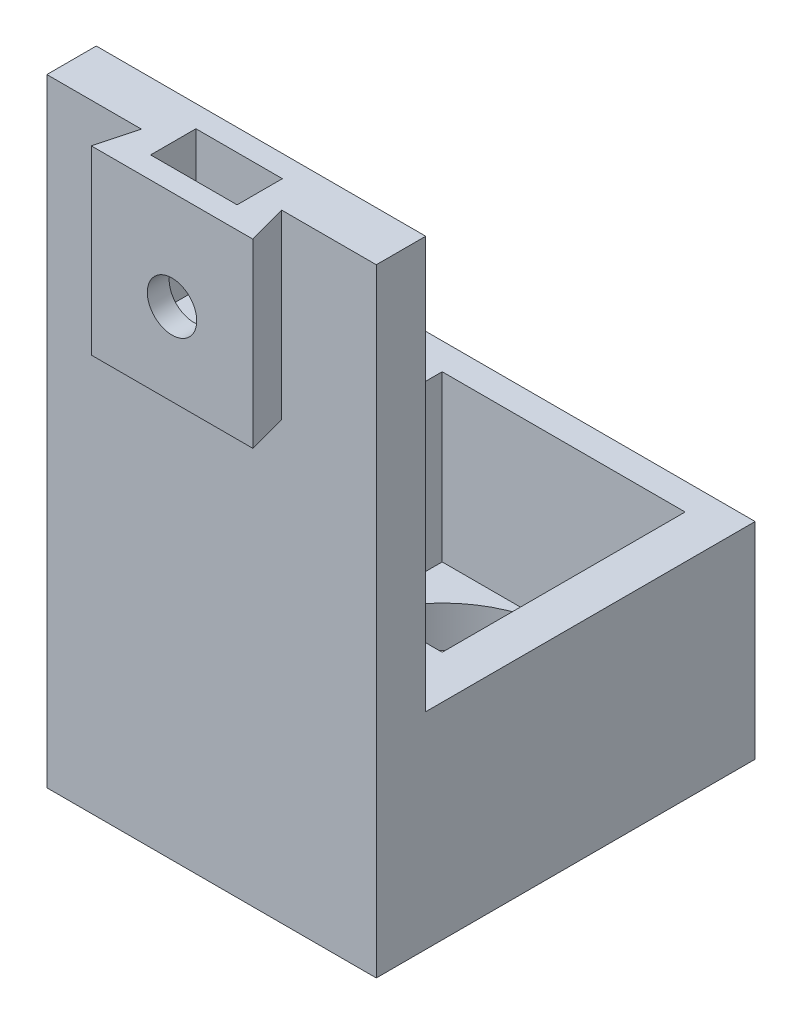
from build123d import *

# Parameters (mm, degrees)
SKIZZE1_W                       = 40
SKIZZE1_H                       = 75
AUFSATZ_LINEAR_AUSTRAGEN1_DEPTH = 6
AUFSATZ_LINEAR_AUSTRAGEN2_DEPTH = 22
SKIZZE3_W                       = 10.5
SKIZZE3_H                       = 5.5
SCHNITT_LINEAR_AUSTRAGEN1_DEPTH = 17
SKIZZE4_R                       = 3
SCHNITT_LINEAR_AUSTRAGEN2_DEPTH = 79.368616167
SKIZZE5_W                       = 40
SKIZZE5_H                       = 25
AUFSATZ_LINEAR_AUSTRAGEN3_DEPTH = 40
SKIZZE6_W                       = 29.5
SKIZZE6_H                       = 29.5
SCHNITT_LINEAR_AUSTRAGEN3_DEPTH = 20
SKIZZE7_R                       = 14.75
SCHNITT_LINEAR_AUSTRAGEN4_DEPTH = 84.066238629


with BuildPart() as part:
    # Skizze1 → Aufsatz-Linear austragen1 (new body)
    with BuildSketch(Plane.XY):
        with Locations((0, 37.5)):
            Rectangle(SKIZZE1_W, SKIZZE1_H)
    extrude(amount=AUFSATZ_LINEAR_AUSTRAGEN1_DEPTH)

    # Skizze2 → Aufsatz-Linear austragen2 (add)
    with BuildSketch(Plane(origin=(0, 75, 0), x_dir=(1, 0, 0), z_dir=(0, 1, 0))):
        Polygon((8.513843876, -6), (-8.513843876, -6), (-9.8, -10.8), (9.8, -10.8), align=None)
    extrude(amount=-AUFSATZ_LINEAR_AUSTRAGEN2_DEPTH)

    # Skizze3 → Schnitt-Linear austragen1 (cut)
    with BuildSketch(Plane(origin=(0, 75, 0), x_dir=(1, 0, 0), z_dir=(0, 1, 0))):
        with Locations((0, -5.4)):
            Rectangle(SKIZZE3_W, SKIZZE3_H)
    extrude(amount=-SCHNITT_LINEAR_AUSTRAGEN1_DEPTH, mode=Mode.SUBTRACT)

    # Skizze4 → Schnitt-Linear austragen2 (cut, through all)
    with BuildSketch(Plane.XY.offset(10.8)):
        with Locations((0, 63)):
            Circle(SKIZZE4_R)
    extrude(amount=-SCHNITT_LINEAR_AUSTRAGEN2_DEPTH, mode=Mode.SUBTRACT)

    # Skizze5 → Aufsatz-Linear austragen3 (add)
    with BuildSketch(Plane(origin=(0, 0, 0), x_dir=(-1, 0, 0), z_dir=(0, 0, -1))):
        with Locations((0, 12.5)):
            Rectangle(SKIZZE5_W, SKIZZE5_H)
    extrude(amount=AUFSATZ_LINEAR_AUSTRAGEN3_DEPTH)

    # Skizze6 → Schnitt-Linear austragen3 (cut)
    with BuildSketch(Plane(origin=(0, 25, 0), x_dir=(1, 0, 0), z_dir=(0, 1, 0))):
        with Locations((0, 22)):
            Rectangle(SKIZZE6_W, SKIZZE6_H)
    extrude(amount=-SCHNITT_LINEAR_AUSTRAGEN3_DEPTH, mode=Mode.SUBTRACT)

    # Skizze7 → Schnitt-Linear austragen4 (cut, through all)
    with BuildSketch(Plane(origin=(0, 5, 0), x_dir=(1, 0, 0), z_dir=(0, 1, 0))):
        with Locations(Location((0, 22, 0), (0, 0, 270))):
            Circle(SKIZZE7_R)
    extrude(amount=-SCHNITT_LINEAR_AUSTRAGEN4_DEPTH, mode=Mode.SUBTRACT)


solid = part.part
